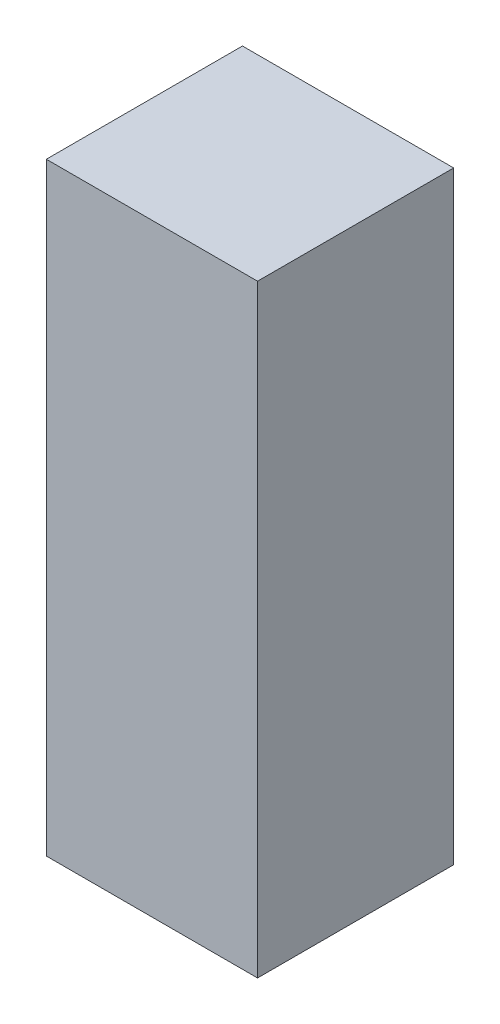
from build123d import *

# Parameters (mm, degrees)
PACK_SARJOR_KAPISI_MENTESE_1_1_START = 20
SKETCH1_W                            = 14
SKETCH1_H                            = 40
PACK_SARJOR_KAPISI_MENTESE_1_1_DEPTH = 13


with BuildPart() as part:
    # Sketch1 → PACK_sarjor_kapisi_mentese_1_1 (new body)
    with BuildSketch(Plane.XY.offset(PACK_SARJOR_KAPISI_MENTESE_1_1_START)):
        with Locations((31, 1100)):
            Rectangle(SKETCH1_W, SKETCH1_H)
    extrude(amount=PACK_SARJOR_KAPISI_MENTESE_1_1_DEPTH)


solid = part.part
